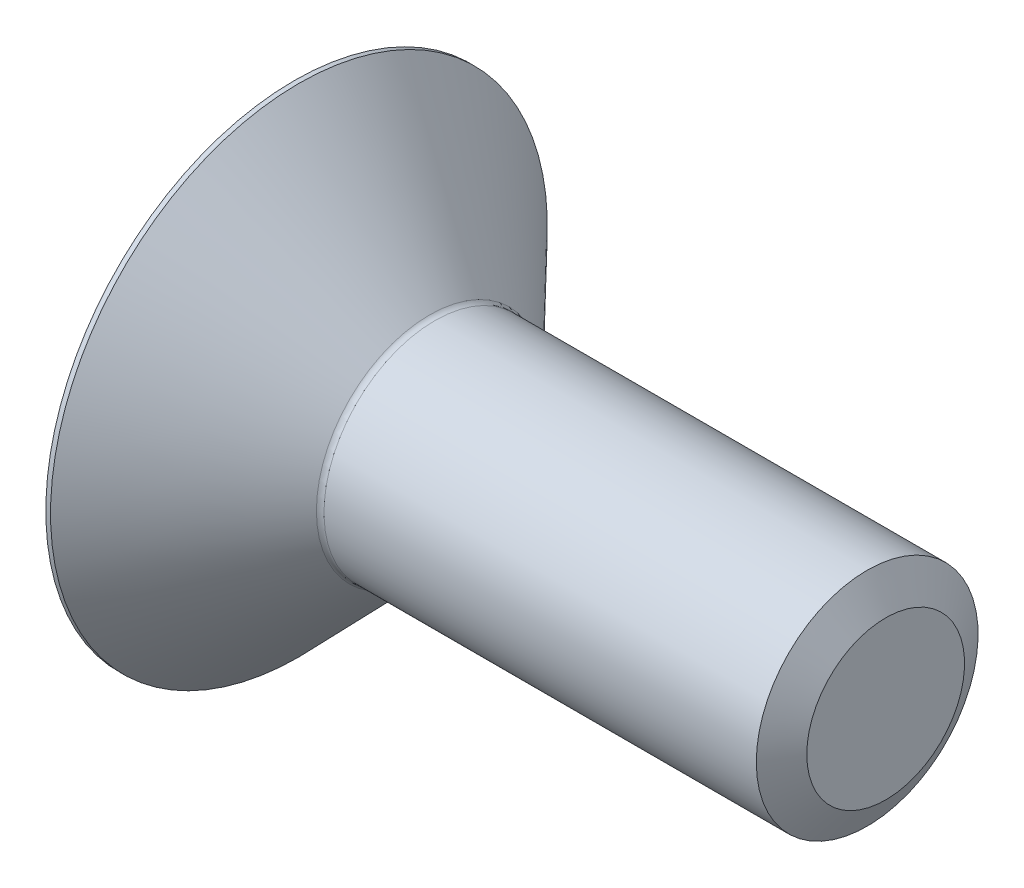
from build123d import *

# Parameters (mm, degrees)
CUT_EXTRUDE_1_DEPTH = 1.86


with BuildPart() as part:
    # 草图1 → 旋转1 (revolve)
    with BuildSketch(Plane.XY):
        with BuildLine():
            Line((0, 1.5), (-6.097552518, 1.5))
            ThreePointArc((-6.097552518, 1.5), (-6.136625631, 1.507949515), (-6.169486498, 1.530534163))
            Line((-6.169486498, 1.530534163), (-7.936181121, 3.36))
            Line((-7.936181121, 3.36), (-8, 3.36))
            Line((-8, 3.36), (-8, 0))
            Line((-8, 0), (0, 0))
            Line((0, 0), (0, 1.5))
        make_face()
    revolve(axis=Axis((0, 0, 0), (-1, 0, 0)))

    # 草图2 → 切除-拉伸1 (cut)
    with BuildSketch(Plane.ZY.offset(8)):
        Polygon((0, 1.154700538), (-1, 0.577350269), (-1, -0.577350269), (0, -1.154700538), (1, -0.577350269), (1, 0.577350269), align=None)
    extrude(amount=-CUT_EXTRUDE_1_DEPTH, mode=Mode.SUBTRACT)

    # 草图6 → 旋转2 (revolve)
    with BuildSketch(Plane.XY):
        Polygon((-6.9, 1.154700538), (-6.233333333, 0), (-5.84, 0), (-5.84, 1.154700538), align=None)
    revolve(axis=Axis((-8, 0, 0), (1, 0, 0)))

    # 草图7 → 切除-旋转2 (revolve, cut)
    with BuildSketch(Plane.XY):
        Polygon((-8, 1.154700538), (-8, 0), (-7.7, 0), align=None)
    revolve(axis=Axis((-8, 0, 0), (1, 0, 0)), mode=Mode.SUBTRACT)

    # 草图4 → 切除-旋转1 (revolve, cut)
    with BuildSketch(Plane.XY):
        Polygon((-0.25, 1.5), (0, 1.066987298), (0.25, 1.5), align=None)
    revolve(axis=Axis((-0.25, 0, 0), (1, 0, 0)), mode=Mode.SUBTRACT)


solid = part.part
